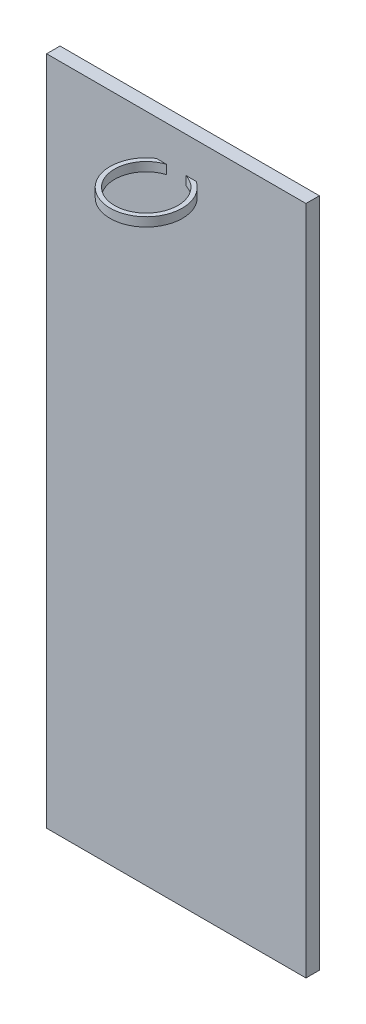
from build123d import *

# Parameters (mm, degrees)
SKETCH1_W           = 58
SKETCH1_H           = 150
BOSS_EXTRUDE1_DEPTH = 3
SKETCH2_R           = 8.076191979
SKETCH2_R_2         = 7.076191979
EXTRUDE_THIN1_DEPTH = 2


with BuildPart() as part:
    # Sketch1 → Boss-Extrude1 (new body)
    with BuildSketch(Plane.XY):
        with Locations((81.977207271, 14.773129951)):
            Rectangle(SKETCH1_W, SKETCH1_H)
    extrude(amount=BOSS_EXTRUDE1_DEPTH)

    # Sketch2 → Extrude-Thin1 (add)
    with BuildSketch(Plane(origin=(0, 79.773129951, 0), x_dir=(1, 0, 0), z_dir=(0, 1, 0))):
        with Locations((81.977207271, -9.724450767)):
            Circle(SKETCH2_R)
        with Locations((81.977207271, -9.724450767)):
            Circle(SKETCH2_R_2, mode=Mode.SUBTRACT)
    extrude(amount=EXTRUDE_THIN1_DEPTH)


solid = part.part
